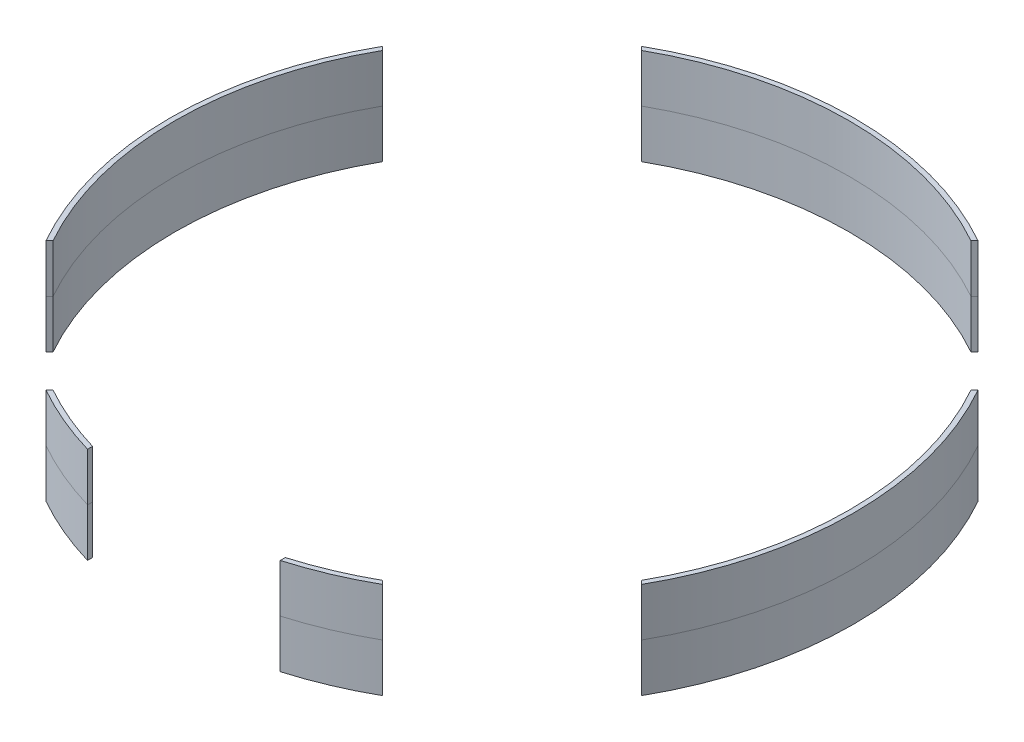
from build123d import *

# Parameters (mm, degrees)
SKETCH1_R           = 142
SKETCH1_R_2         = 140
BOSS_EXTRUDE1_DEPTH = 20
SKETCH2_R           = 142
SKETCH2_R_2         = 140
BOSS_EXTRUDE2_DEPTH = 20
SKETCH3_W           = 80
SKETCH3_H           = 7.83592135
CUT_EXTRUDE1_DEPTH  = 205.763277958
CUT_EXTRUDE2_DEPTH  = 205.763277958


with BuildPart() as part:
    # Sketch1 → Boss-Extrude1 (new body)
    with BuildSketch(Plane(origin=(0, 0, 0), x_dir=(1, 0, 0), z_dir=(0, 1, 0))):
        with Locations(Location((0, 0, 0), (0, 0, 270))):
            Circle(SKETCH1_R)
        with Locations(Location((0, 0, 0), (0, 0, 270))):
            Circle(SKETCH1_R_2, mode=Mode.SUBTRACT)
    extrude(amount=BOSS_EXTRUDE1_DEPTH)


with BuildPart() as body_2:
    # Sketch2 → Boss-Extrude2 (new body)
    with BuildSketch(Plane(origin=(0, 20, 0), x_dir=(1, 0, 0), z_dir=(0, 1, 0))):
        with Locations(Location((0, 0, 0), (0, 0, 270))):
            Circle(SKETCH2_R)
        with Locations(Location((0, 0, 0), (0, 0, 270))):
            Circle(SKETCH2_R_2, mode=Mode.SUBTRACT)
    extrude(amount=BOSS_EXTRUDE2_DEPTH)


with BuildPart() as cut_extrude1_tool:
    # Sketch3 → Cut-Extrude1 (new, through all)
    with BuildSketch(Plane(origin=(0, 40, 0), x_dir=(1, 0, 0), z_dir=(0, 1, 0))):
        with Locations((0, -138.082039325)):
            Rectangle(SKETCH3_W, SKETCH3_H)
    extrude(amount=-CUT_EXTRUDE1_DEPTH)


with BuildPart() as part_1:
    add(part.part)

    # Cut-Extrude1: cut by cut_extrude1_tool
    add(cut_extrude1_tool.part, mode=Mode.SUBTRACT)


with BuildPart() as body_2_1:
    add(body_2.part)

    # Cut-Extrude1: cut by cut_extrude1_tool
    add(cut_extrude1_tool.part, mode=Mode.SUBTRACT)


with BuildPart() as cut_extrude2_tool:
    # Sketch4 → Cut-Extrude2 (new, through all)
    with BuildSketch(Plane(origin=(0, 40, 0), x_dir=(1, 0, 0), z_dir=(0, 1, 0))):
        Polygon((-127.279220614, 73.539105243), (-73.539105243, 127.279220614), (-68.408481347, 122.148596717), (-122.148596717, 68.408481347), align=None)
        Polygon((68.408481347, -122.148596717), (122.148596717, -68.408481347), (127.279220614, -73.539105243), (73.539105243, -127.279220614), align=None)
        Polygon((73.539105243, 127.279220614), (127.279220614, 73.539105243), (122.148596717, 68.408481347), (68.408481347, 122.148596717), align=None)
        Polygon((-127.279220614, -73.539105243), (-73.539105243, -127.279220614), (-68.408481347, -122.148596717), (-122.148596717, -68.408481347), align=None)
    extrude(amount=-CUT_EXTRUDE2_DEPTH)


with BuildPart() as part_2:
    add(part_1.part)

    # Cut-Extrude2: cut by cut_extrude2_tool
    add(cut_extrude2_tool.part, mode=Mode.SUBTRACT)


with BuildPart() as body_2_2:
    add(body_2_1.part)

    # Cut-Extrude2: cut by cut_extrude2_tool
    add(cut_extrude2_tool.part, mode=Mode.SUBTRACT)


with BuildPart() as cut_extrude2_piece_1:
    # of the separate pieces the step leaves, piece 1, a body of its own (cut_extrude2_pieces)
    add(part_2.part.solids().sort_by_distance((122.148596717, 0, 68.408481347))[0])


with BuildPart() as cut_extrude2_piece_2:
    # of the separate pieces the step leaves, piece 2, a body of its own (cut_extrude2_pieces)
    add(part_2.part.solids().sort_by_distance((-122.148596717, 0, -68.408481347))[0])


with BuildPart() as cut_extrude2_piece_3:
    # of the separate pieces the step leaves, piece 3, a body of its own (cut_extrude2_pieces)
    add(part_2.part.solids().sort_by_distance((68.408481347, 0, -122.148596717))[0])


with BuildPart() as cut_extrude2_piece_4:
    # of the separate pieces the step leaves, piece 4, a body of its own (cut_extrude2_pieces)
    add(part_2.part.solids().sort_by_distance((40, 0, 136.249770642))[0])


with BuildPart() as cut_extrude2_piece_5:
    # of the separate pieces the step leaves, piece 5, a body of its own (cut_extrude2_pieces)
    add(part_2.part.solids().sort_by_distance((-68.408481347, 0, 122.148596717))[0])


with BuildPart() as cut_extrude2_piece_1_of_body_2:
    # of the separate pieces the step leaves, piece 1, a body of its own (cut_extrude2_pieces_of_body_2)
    add(body_2_2.part.solids().sort_by_distance((122.148596717, 20, 68.408481347))[0])


with BuildPart() as cut_extrude2_piece_2_of_body_2:
    # of the separate pieces the step leaves, piece 2, a body of its own (cut_extrude2_pieces_of_body_2)
    add(body_2_2.part.solids().sort_by_distance((-122.148596717, 20, -68.408481347))[0])


with BuildPart() as cut_extrude2_piece_3_of_body_2:
    # of the separate pieces the step leaves, piece 3, a body of its own (cut_extrude2_pieces_of_body_2)
    add(body_2_2.part.solids().sort_by_distance((68.408481347, 20, -122.148596717))[0])


with BuildPart() as cut_extrude2_piece_4_of_body_2:
    # of the separate pieces the step leaves, piece 4, a body of its own (cut_extrude2_pieces_of_body_2)
    add(body_2_2.part.solids().sort_by_distance((40, 20, 136.249770642))[0])


with BuildPart() as cut_extrude2_piece_5_of_body_2:
    # of the separate pieces the step leaves, piece 5, a body of its own (cut_extrude2_pieces_of_body_2)
    add(body_2_2.part.solids().sort_by_distance((-68.408481347, 20, 122.148596717))[0])


solid = Compound([cut_extrude2_piece_1.part, cut_extrude2_piece_2.part, cut_extrude2_piece_3.part, cut_extrude2_piece_4.part, cut_extrude2_piece_5.part, cut_extrude2_piece_1_of_body_2.part, cut_extrude2_piece_2_of_body_2.part, cut_extrude2_piece_3_of_body_2.part, cut_extrude2_piece_4_of_body_2.part, cut_extrude2_piece_5_of_body_2.part])
